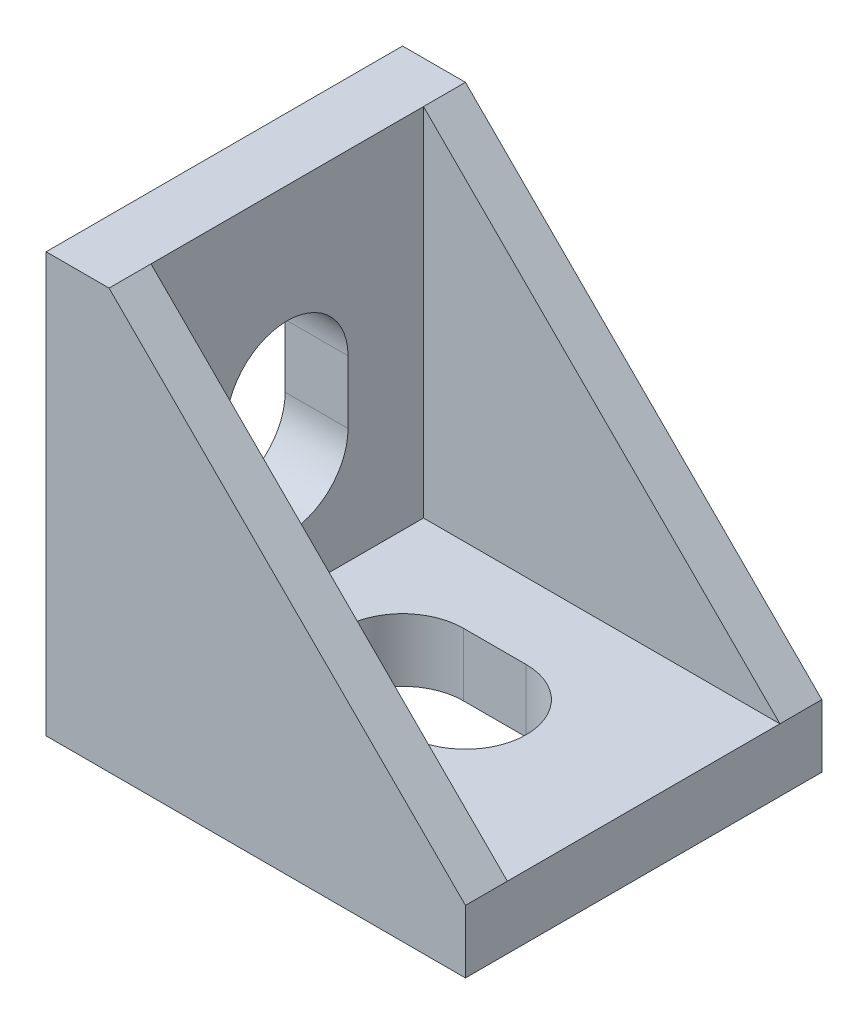
from build123d import *

# Parameters (mm, degrees)
BOSS_EXTRUDE1_DEPTH = 8.5
CUT_EXTRUDE1_START  = -2
CUT_EXTRUDE1_DEPTH  = 13
CUT_EXTRUDE2_DEPTH  = 28.590759323
CUT_EXTRUDE3_DEPTH  = 28.590759323
SKETCH5_W           = 4
SKETCH5_H           = 1.85
BOSS_EXTRUDE2_DEPTH = 1


with BuildPart() as part:
    # Sketch1 → Boss-Extrude1 (new, symmetric)
    with BuildSketch(Plane.XY):
        Polygon((0, 0), (0, 20), (3, 20), (20, 3), (20, 0), align=None)
    extrude(amount=BOSS_EXTRUDE1_DEPTH, both=True)

    # Sketch2 → Cut-Extrude1 (cut)
    with BuildSketch(Plane.XY.offset(8.5).offset(CUT_EXTRUDE1_START)):
        Polygon((3, 20), (3, 3), (20, 3), align=None)
    extrude(amount=-CUT_EXTRUDE1_DEPTH, mode=Mode.SUBTRACT)

    # Sketch3 → Cut-Extrude2 (cut, through all)
    with BuildSketch(Plane(origin=(3, 0, 0), x_dir=(0, 0, -1), z_dir=(1, 0, 0))):
        with BuildLine():
            Line((2.9, 11.5), (2.9, 8.5))
            ThreePointArc((2.9, 8.5), (0, 5.6), (-2.9, 8.5))
            Line((-2.9, 8.5), (-2.9, 11.5))
            ThreePointArc((-2.9, 11.5), (0, 14.4), (2.9, 11.5))
        make_face()
    extrude(amount=-CUT_EXTRUDE2_DEPTH, mode=Mode.SUBTRACT)

    # Sketch4 → Cut-Extrude3 (cut, through all)
    with BuildSketch(Plane(origin=(0, 3, 0), x_dir=(1, 0, 0), z_dir=(0, 1, 0))):
        with BuildLine():
            Line((11.5, -2.9), (8.5, -2.9))
            ThreePointArc((8.5, -2.9), (5.6, 0), (8.5, 2.9))
            Line((8.5, 2.9), (11.5, 2.9))
            ThreePointArc((11.5, 2.9), (14.4, 0), (11.5, -2.9))
        make_face()
    extrude(amount=-CUT_EXTRUDE3_DEPTH, mode=Mode.SUBTRACT)

    # Sketch5 → Boss-Extrude2 (add)
    with BuildSketch(Plane.ZY):
        with Locations((0, 17.575)):
            Rectangle(SKETCH5_W, SKETCH5_H)
        with Locations((0, 2.425)):
            Rectangle(SKETCH5_W, SKETCH5_H)
    extrude(amount=BOSS_EXTRUDE2_DEPTH)


solid = part.part
